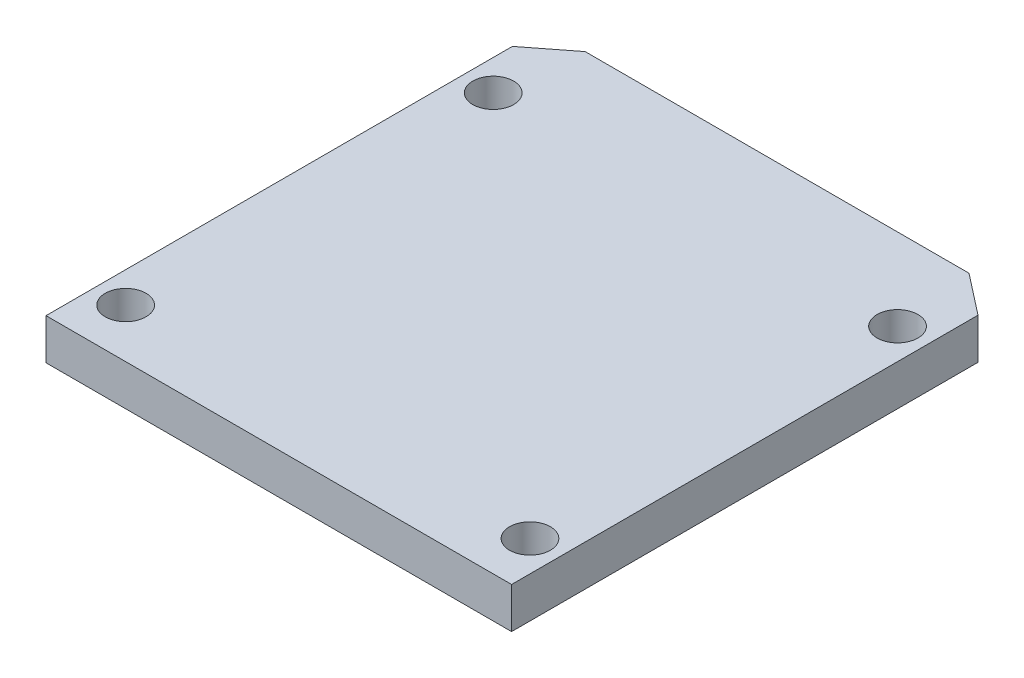
from build123d import *

# Parameters (mm, degrees)
SKETCH1_W           = 57
SKETCH1_H           = 62.1
SKETCH1_W_2         = 42
SKETCH1_H_2         = 49.6
BOSS_EXTRUDE1_DEPTH = 5
SKETCH2_W           = 42
SKETCH2_H           = 49.6
BOSS_EXTRUDE2_DEPTH = 5
M6_TAPPED_HOLE1_D   = 5
CUT_EXTRUDE1_DEPTH  = 5


with BuildPart() as part:
    # Sketch1 → Boss-Extrude1 (new body)
    with BuildSketch(Plane(origin=(0, 0, 0), x_dir=(1, 0, 0), z_dir=(0, 1, 0))):
        with Locations((3.372056515, -19.15989011)):
            Rectangle(SKETCH1_W, SKETCH1_H)
        with Locations((3.372056515, -17.90989011)):
            Rectangle(SKETCH1_W_2, SKETCH1_H_2, mode=Mode.SUBTRACT)
    extrude(amount=BOSS_EXTRUDE1_DEPTH)

    # Sketch2 → Boss-Extrude2 (add)
    with BuildSketch(Plane.XZ):
        with Locations((3.372056515, 17.90989011)):
            Rectangle(SKETCH2_W, SKETCH2_H)
    extrude(amount=-BOSS_EXTRUDE2_DEPTH)

    # M6 Tapped Hole1 (through all)
    with Locations(Plane(origin=(-21.377943485, 5, -0.79010989), x_dir=(0, 0, 1), z_dir=(0, 1, 0))):
        with Locations((0, 0), (45, 0), (45, 49.5), (0, 49.5)):
            Hole(M6_TAPPED_HOLE1_D / 2)

    # Sketch9 → Cut-Extrude1 (cut)
    with BuildSketch(Plane(origin=(0, 5, 0), x_dir=(1, 0, 0), z_dir=(0, 1, 0))):
        Polygon((-25.127943485, 11.89010989), (-25.127943485, 6.89010989), (-20.128034648, 10.790006378), (26.871965352, 10.790148591), (31.872056515, 6.89010989), (31.872056515, 11.89010989), align=None)
    extrude(amount=-CUT_EXTRUDE1_DEPTH, mode=Mode.SUBTRACT)


solid = part.part
